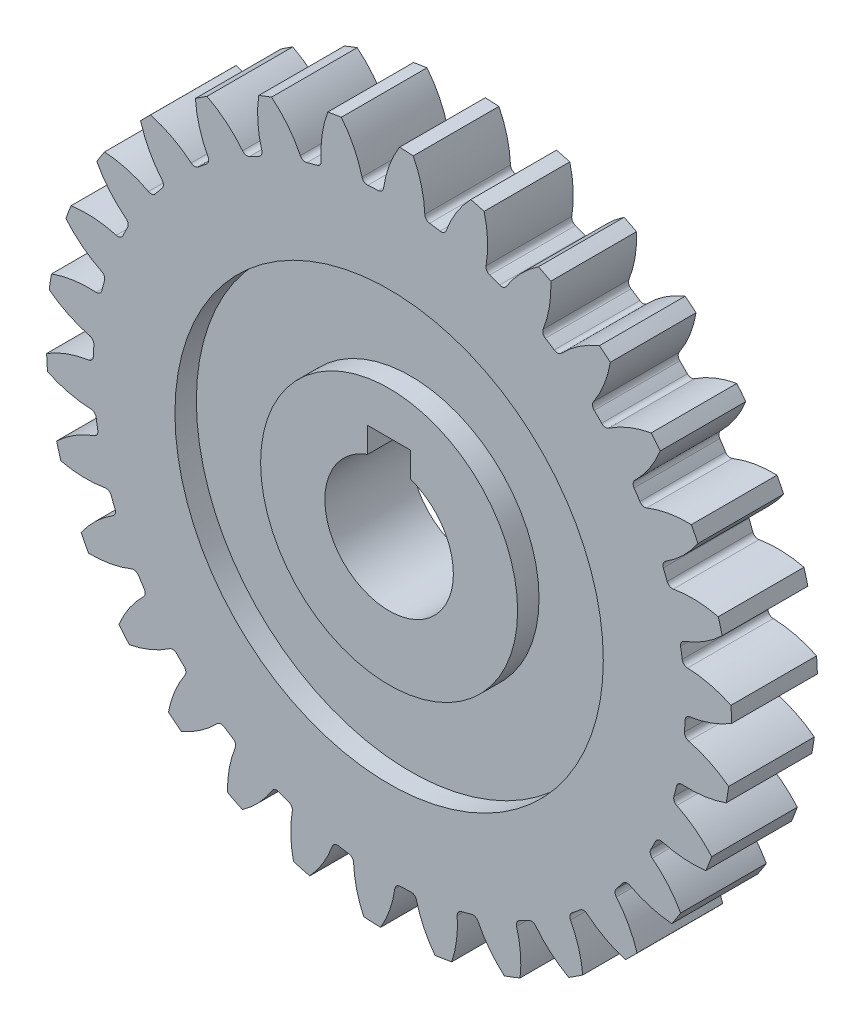
from build123d import *

# Parameters (mm, degrees)
CROQUIS1_R              = 80
SALIENTE_EXTRUIR1_DEPTH = 20
CORTAR_EXTRUIR2_DEPTH   = 115.891252931
MATRIZC1_COUNT          = 30
CROQUIS3_R              = 50
CORTAR_EXTRUIR3_DEPTH   = 5
CROQUIS4_R              = 15
CORTAR_EXTRUIR4_DEPTH   = 115.087891524
SALIENTE_EXTRUIR2_START = 5
CROQUIS6_R              = 30
CROQUIS6_R_2            = 15
SALIENTE_EXTRUIR2_DEPTH = 5
CROQUIS7_W              = 10
CROQUIS7_H              = 10
CORTAR_EXTRUIR5_DEPTH   = 115.852283358


with BuildPart() as part:
    # Croquis1 → Saliente-Extruir1 (new body)
    with BuildSketch(Plane.XY):
        Circle(CROQUIS1_R)
    extrude(amount=SALIENTE_EXTRUIR1_DEPTH)

    # Croquis2 → Cortar-Extruir2 (cut, through all)
    with BuildSketch(Plane.XY.offset(20)):
        with BuildLine():
            ThreePointArc((-1.294003245, 69.820305479), (0.033120291, 75.090468292), (2.440745731, 79.962758583))
            ThreePointArc((2.440745731, 79.962758583), (-4.373333333, 79.880372781), (-11.15567945, 79.218374232))
            ThreePointArc((-11.15567945, 79.218374232), (-8.230536954, 74.638045169), (-6.336002642, 69.544263402))
            ThreePointArc((-6.336002642, 69.544263402), (-5.836139203, 68.810928348), (-4.982190072, 68.569237141))
            ThreePointArc((-4.982190072, 68.569237141), (-3.758333333, 68.647195358), (-2.533280764, 68.703311336))
            ThreePointArc((-2.533280764, 68.703311336), (-1.710820983, 69.036783475), (-1.294003245, 69.820305479))
        make_face()
    cortar_extruir2 = extrude(amount=-CORTAR_EXTRUIR2_DEPTH, mode=Mode.SUBTRACT)

    # MatrizC1: Cortar-Extruir2 ×30 about axis
    matrizc1_axis = Axis((0.018846508, -0.344237663, 0), (0, 0, 1))
    for i in range(1, MATRIZC1_COUNT):
        add(cortar_extruir2.rotate(matrizc1_axis, i * 360 / MATRIZC1_COUNT), mode=Mode.SUBTRACT)

    # Croquis3 → Cortar-Extruir3 (cut)
    with BuildSketch(Plane.XY.offset(20)):
        Circle(CROQUIS3_R)
    extrude(amount=-CORTAR_EXTRUIR3_DEPTH, mode=Mode.SUBTRACT)

    # Croquis4 → Cortar-Extruir4 (cut, through all)
    with BuildSketch(Plane.XY.offset(15)):
        Circle(CROQUIS4_R)
    extrude(amount=-CORTAR_EXTRUIR4_DEPTH, mode=Mode.SUBTRACT)

    # Croquis6 → Saliente-Extruir2 (add)
    with BuildSketch(Plane.XY.offset(15).offset(SALIENTE_EXTRUIR2_START)):
        Circle(CROQUIS6_R)
        Circle(CROQUIS6_R_2, mode=Mode.SUBTRACT)
    extrude(amount=-SALIENTE_EXTRUIR2_DEPTH)

    # Croquis7 → Cortar-Extruir5 (cut, through all)
    with BuildSketch(Plane.XY.offset(20)):
        with Locations((0, 15)):
            Rectangle(CROQUIS7_W, CROQUIS7_H)
    extrude(amount=-CORTAR_EXTRUIR5_DEPTH, mode=Mode.SUBTRACT)


solid = part.part
